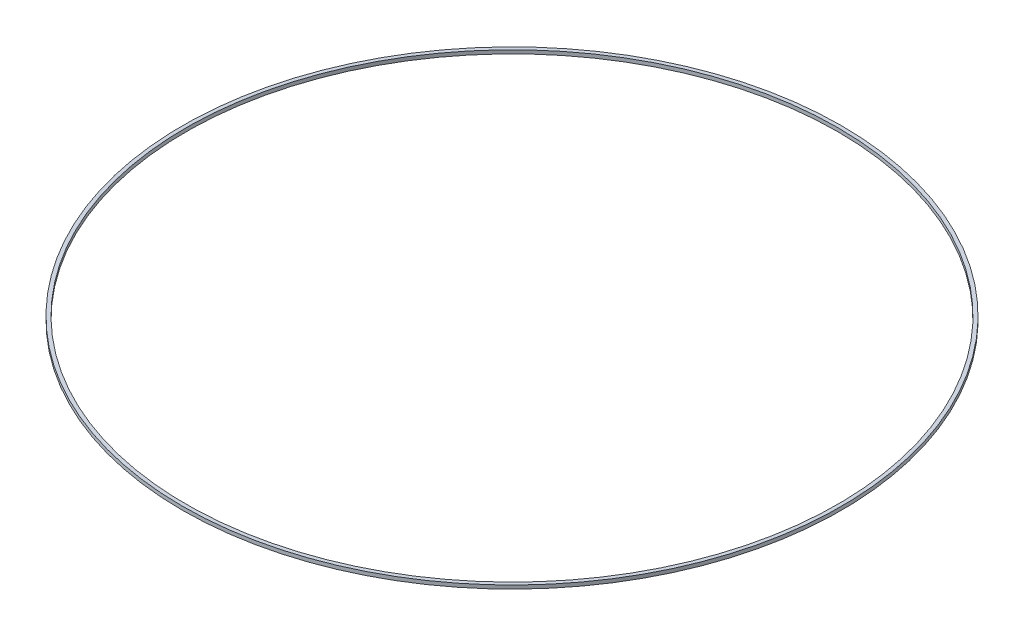
from build123d import *

# Parameters (mm, degrees)
SKETCH1_W = 2.121320343
SKETCH1_H = 2.121320344


with BuildPart() as part:
    # Sketch1 → Revolve1 (revolve)
    with BuildSketch(Plane.XY, mode=Mode.PRIVATE) as revolve1_sk:
        with Locations((-195.229236694, 1.060660172)):
            Rectangle(SKETCH1_W, SKETCH1_H)
    revolve(revolve1_sk.sketch.rotate(Axis((0, 0, 0), (0, 1, 0)), 270), axis=Axis((0, 0, 0), (0, 1, 0)))


solid = part.part
